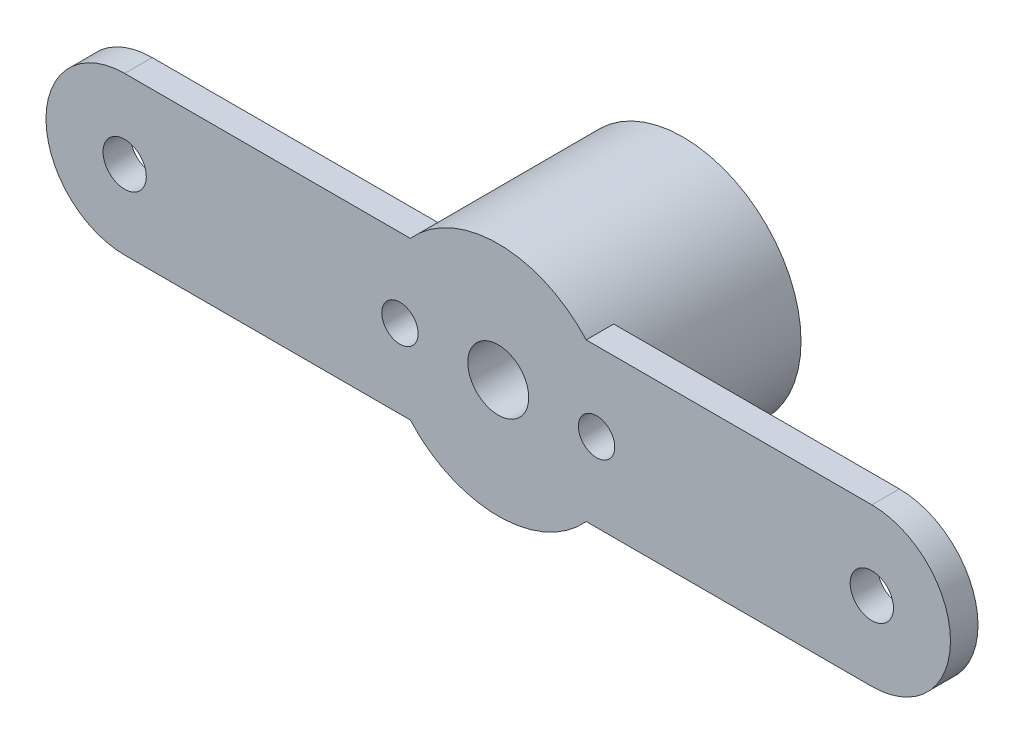
from build123d import *
from build123d.topology import SkipClean

# Parameters (mm, degrees)
SKETCH_1_R      = 1.55
SKETCH_1_R_2    = 1.1
SKETCH_1_R_3    = 0.925
EXTRUDE_1_DEPTH = 1.4
EXTRUDE_START   = 8
SKETCH_2_R      = 6
SKETCH_2_R_2    = 1.55
SKETCH_2_R_3    = 0.925
EXTRUDE_2_DEPTH = 8


with BuildPart() as part:
    # 草图1 → 凸台-拉伸1 (new body)
    with BuildSketch(Plane.XY):
        with BuildLine():
            Line((4.472135955, 4), (19, 4))
            ThreePointArc((19, 4), (23, 0), (19, -4))
            Line((19, -4), (4.472135955, -4))
            ThreePointArc((4.472135955, -4), (0, -6), (-4.472135955, -4))
            Line((-4.472135955, -4), (-19, -4))
            ThreePointArc((-19, -4), (-23, 0), (-19, 4))
            Line((-19, 4), (-4.472135955, 4))
            ThreePointArc((-4.472135955, 4), (0, 6), (4.472135955, 4))
        make_face()
        Circle(SKETCH_1_R, mode=Mode.SUBTRACT)
        with Locations((19, 0)):
            Circle(SKETCH_1_R_2, mode=Mode.SUBTRACT)
        with Locations((-19, 0)):
            Circle(SKETCH_1_R_2, mode=Mode.SUBTRACT)
        with Locations((-5, 0)):
            Circle(SKETCH_1_R_3, mode=Mode.SUBTRACT)
        with Locations((5, 0)):
            Circle(SKETCH_1_R_3, mode=Mode.SUBTRACT)
    extrude(amount=EXTRUDE_1_DEPTH)

    # 草图2 → 凸台-拉伸2 (add)
    with SkipClean():  # the faces are left unmerged after this step: merging them gives an invalid solid
        with BuildSketch(Plane(origin=(0, 0, 0), x_dir=(-1, 0, 0), z_dir=(0, 0, -1)).offset(EXTRUDE_START)):
            Circle(SKETCH_2_R)
            Circle(SKETCH_2_R_2, mode=Mode.SUBTRACT)
            with Locations((-5, 0)):
                Circle(SKETCH_2_R_3, mode=Mode.SUBTRACT)
            with Locations((5, 0)):
                Circle(SKETCH_2_R_3, mode=Mode.SUBTRACT)
        extrude(amount=-EXTRUDE_2_DEPTH)


solid = part.part
